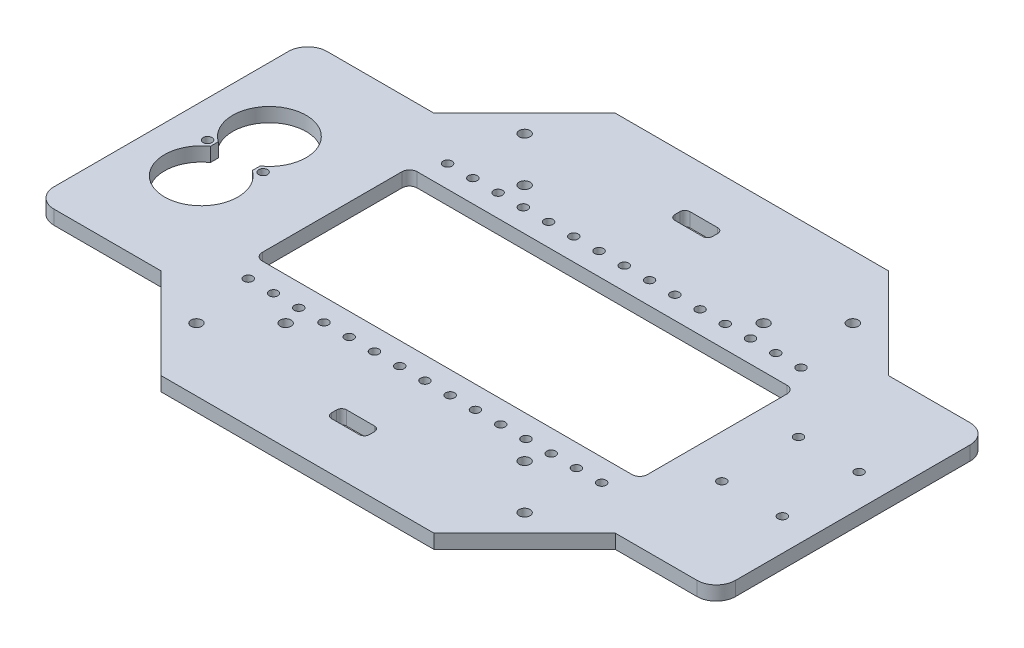
from build123d import *

# Parameters (mm, degrees)
BOSS_EXTRUDE1_DEPTH = 5.588
SKETCH2_R           = 2.159
CUT_EXTRUDE1_DEPTH  = 158.413946399
SKETCH3_W           = 152.51
SKETCH3_H           = 61.34
CUT_EXTRUDE2_DEPTH  = 158.413946399
BOSS_EXTRUDE2_DEPTH = 5.588
BOSS_EXTRUDE3_DEPTH = 5.588
SKETCH7_R           = 1.75
CUT_EXTRUDE4_DEPTH  = 187.865769606
SKETCH8_R           = 1.75
CUT_EXTRUDE6_DEPTH  = 187.865769606
SKETCH9_R           = 1.75
CUT_EXTRUDE8_DEPTH  = 187.865769606
CUT_EXTRUDE9_DEPTH  = 187.865769606
FILLET1_R           = 3


with BuildPart() as part:
    # Sketch1 → Boss-Extrude1 (new body)
    with BuildSketch(Plane(origin=(0, 0, 0), x_dir=(1, 0, 0), z_dir=(0, 1, 0))):
        Polygon((-73.254183378, 28.522688753), (-37.333158894, 64.443713237), (70.824792138, 64.443713237), (106.745816622, 28.522688753), (106.745816622, -79.635262279), (70.824792138, -115.556286763), (-37.333158894, -115.556286763), (-73.254183378, -79.635262279), align=None)
    extrude(amount=BOSS_EXTRUDE1_DEPTH)

    # Sketch2 → Cut-Extrude1 (cut, through all)
    with BuildSketch(Plane(origin=(0, 5.588, 0), x_dir=(1, 0, 0), z_dir=(0, 1, 0))):
        with Locations(Location((-48.254183378, 39.443713237, 0), (0, 0, 270))):
            Circle(SKETCH2_R)
        with Locations(Location((-30.581039332, 21.770569191, 0), (0, 0, 270))):
            Circle(SKETCH2_R)
        with Locations(Location((-48.254183378, -90.556286763, 0), (0, 0, 270))):
            Circle(SKETCH2_R)
        with Locations(Location((-30.581039332, -72.883142717, 0), (0, 0, 270))):
            Circle(SKETCH2_R)
        with Locations(Location((64.072672576, 21.770569191, 0), (0, 0, 270))):
            Circle(SKETCH2_R)
        with Locations(Location((81.745816622, 39.443713237, 0), (0, 0, 270))):
            Circle(SKETCH2_R)
        with Locations(Location((64.072672576, -72.883142717, 0), (0, 0, 270))):
            Circle(SKETCH2_R)
        with Locations(Location((81.745816622, -90.556286763, 0), (0, 0, 270))):
            Circle(SKETCH2_R)
    extrude(amount=-CUT_EXTRUDE1_DEPTH, mode=Mode.SUBTRACT)

    # Sketch3 → Cut-Extrude2 (cut, through all)
    with BuildSketch(Plane(origin=(0, 5.588, 0), x_dir=(1, 0, 0), z_dir=(0, 1, 0))):
        with Locations((16.745816622, -25.556286763)):
            Rectangle(SKETCH3_W, SKETCH3_H)
    extrude(amount=-CUT_EXTRUDE2_DEPTH, mode=Mode.SUBTRACT)

    # Sketch5 → Boss-Extrude2 (add)
    with BuildSketch(Plane(origin=(0, 5.588, 0), x_dir=(1, 0, 0), z_dir=(0, 1, 0))):
        with BuildLine():
            Line((-73.254183378, -79.635262279), (-115.634183378, -79.635262279))
            ThreePointArc((-115.634183378, -79.635262279), (-121.02233705, -77.403415951), (-123.254183378, -72.015262279))
            Line((-123.254183378, -72.015262279), (-123.254183378, 20.902688753))
            ThreePointArc((-123.254183378, 20.902688753), (-121.02233705, 26.290842426), (-115.634183378, 28.522688753))
            Line((-115.634183378, 28.522688753), (-73.254183378, 28.522688753))
            Line((-73.254183378, 28.522688753), (-73.254183378, -79.635262279))
        make_face()
    extrude(amount=-BOSS_EXTRUDE2_DEPTH)

    # Sketch6 → Boss-Extrude3 (add)
    with BuildSketch(Plane(origin=(0, 5.588, 0), x_dir=(1, 0, 0), z_dir=(0, 1, 0))):
        with BuildLine():
            Line((106.745816622, 28.522688753), (139.125816622, 28.522688753))
            ThreePointArc((139.125816622, 28.522688753), (144.513970295, 26.290842426), (146.745816622, 20.902688753))
            Line((146.745816622, 20.902688753), (146.745816622, -72.015262279))
            ThreePointArc((146.745816622, -72.015262279), (144.513970295, -77.403415951), (139.125816622, -79.635262279))
            Line((139.125816622, -79.635262279), (106.745816622, -79.635262279))
            Line((106.745816622, -79.635262279), (106.745816622, 28.522688753))
        make_face()
    extrude(amount=-BOSS_EXTRUDE3_DEPTH)

    # Sketch7 → Cut-Extrude4 (cut, through all)
    with BuildSketch(Plane(origin=(0, 5.588, 0), x_dir=(1, 0, 0), z_dir=(0, 1, 0))):
        with Locations(Location((110.045816622, -10.356286763, 0), (0, 0, 270))):
            Circle(SKETCH7_R)
        with Locations(Location((134.045816622, -10.356286763, 0), (0, 0, 270))):
            Circle(SKETCH7_R)
        with Locations(Location((110.045816622, -40.756286763, 0), (0, 0, 270))):
            Circle(SKETCH7_R)
        with Locations(Location((134.045816622, -40.756286763, 0), (0, 0, 270))):
            Circle(SKETCH7_R)
    extrude(amount=-CUT_EXTRUDE4_DEPTH, mode=Mode.SUBTRACT)

    # Sketch8 → Cut-Extrude6 (cut, through all)
    with BuildSketch(Plane(origin=(0, 5.588, 0), x_dir=(1, 0, 0), z_dir=(0, 1, 0))):
        with Locations(Location((-108.854183378, -25.556286763, 0), (0, 0, 270))):
            Circle(SKETCH8_R)
        with Locations(Location((-86.854183378, -25.556286763, 0), (0, 0, 270))):
            Circle(SKETCH8_R)
        with BuildLine():
            Line((-106.154183378, -24.006705166), (-106.154183378, -27.10586836))
            ThreePointArc((-106.154183378, -27.10586836), (-97.854183378, -53.606286763), (-89.554183378, -27.10586836))
            Line((-89.554183378, -27.10586836), (-89.554183378, -24.006705166))
            ThreePointArc((-89.554183378, -24.006705166), (-97.854183378, 2.493713237), (-106.154183378, -24.006705166))
        make_face()
    extrude(amount=-CUT_EXTRUDE6_DEPTH, mode=Mode.SUBTRACT)

    # Sketch9 → Cut-Extrude8 (cut, through all)
    with BuildSketch(Plane(origin=(0, 5.588, 0), x_dir=(1, 0, 0), z_dir=(0, 1, 0))):
        with Locations(Location((-53.254183378, 13.923713237, 0), (0, 0, 270))):
            Circle(SKETCH9_R)
        with Locations(Location((-43.254183378, 13.923713237, 0), (0, 0, 270))):
            Circle(SKETCH9_R)
        with Locations(Location((-33.254183378, 13.923713237, 0), (0, 0, 270))):
            Circle(SKETCH9_R)
        with Locations(Location((-23.254183378, 13.923713237, 0), (0, 0, 270))):
            Circle(SKETCH9_R)
        with Locations(Location((-13.254183378, 13.923713237, 0), (0, 0, 270))):
            Circle(SKETCH9_R)
        with Locations(Location((-3.254183378, 13.923713237, 0), (0, 0, 270))):
            Circle(SKETCH9_R)
        with Locations(Location((6.745816622, 13.923713237, 0), (0, 0, 270))):
            Circle(SKETCH9_R)
        with Locations(Location((16.745816622, 13.923713237, 0), (0, 0, 270))):
            Circle(SKETCH9_R)
        with Locations(Location((26.745816622, 13.923713237, 0), (0, 0, 270))):
            Circle(SKETCH9_R)
        with Locations(Location((36.745816622, 13.923713237, 0), (0, 0, 270))):
            Circle(SKETCH9_R)
        with Locations(Location((46.745816622, 13.923713237, 0), (0, 0, 270))):
            Circle(SKETCH9_R)
        with Locations(Location((56.745816622, 13.923713237, 0), (0, 0, 270))):
            Circle(SKETCH9_R)
        with Locations(Location((66.745816622, 13.923713237, 0), (0, 0, 270))):
            Circle(SKETCH9_R)
        with Locations(Location((76.745816622, 13.923713237, 0), (0, 0, 270))):
            Circle(SKETCH9_R)
        with Locations(Location((86.745816622, 13.923713237, 0), (0, 0, 270))):
            Circle(SKETCH9_R)
        with Locations(Location((-53.254183378, -65.036286763, 0), (0, 0, 270))):
            Circle(SKETCH9_R)
        with Locations(Location((-43.254183378, -65.036286763, 0), (0, 0, 270))):
            Circle(SKETCH9_R)
        with Locations(Location((-33.254183378, -65.036286763, 0), (0, 0, 270))):
            Circle(SKETCH9_R)
        with Locations(Location((-23.254183378, -65.036286763, 0), (0, 0, 270))):
            Circle(SKETCH9_R)
        with Locations(Location((-13.254183378, -65.036286763, 0), (0, 0, 270))):
            Circle(SKETCH9_R)
        with Locations(Location((-3.254183378, -65.036286763, 0), (0, 0, 270))):
            Circle(SKETCH9_R)
        with Locations(Location((6.745816622, -65.036286763, 0), (0, 0, 270))):
            Circle(SKETCH9_R)
        with Locations(Location((16.745816622, -65.036286763, 0), (0, 0, 270))):
            Circle(SKETCH9_R)
        with Locations(Location((26.745816622, -65.036286763, 0), (0, 0, 270))):
            Circle(SKETCH9_R)
        with Locations(Location((36.745816622, -65.036286763, 0), (0, 0, 270))):
            Circle(SKETCH9_R)
        with Locations(Location((46.745816622, -65.036286763, 0), (0, 0, 270))):
            Circle(SKETCH9_R)
        with Locations(Location((56.745816622, -65.036286763, 0), (0, 0, 270))):
            Circle(SKETCH9_R)
        with Locations(Location((66.745816622, -65.036286763, 0), (0, 0, 270))):
            Circle(SKETCH9_R)
        with Locations(Location((76.745816622, -65.036286763, 0), (0, 0, 270))):
            Circle(SKETCH9_R)
        with Locations(Location((86.745816622, -65.036286763, 0), (0, 0, 270))):
            Circle(SKETCH9_R)
    extrude(amount=-CUT_EXTRUDE8_DEPTH, mode=Mode.SUBTRACT)

    # Sketch10 → Cut-Extrude9 (cut, through all)
    with BuildSketch(Plane(origin=(0, 5.588, 0), x_dir=(1, 0, 0), z_dir=(0, 1, 0))):
        with BuildLine():
            Line((11.245816622, 45.443713237), (22.245816622, 45.443713237))
            ThreePointArc((22.245816622, 45.443713237), (23.660030185, 44.8579268), (24.245816622, 43.443713237))
            Line((24.245816622, 43.443713237), (24.245816622, 41.443713237))
            ThreePointArc((24.245816622, 41.443713237), (23.660030185, 40.029499675), (22.245816622, 39.443713237))
            Line((22.245816622, 39.443713237), (11.245816622, 39.443713237))
            ThreePointArc((11.245816622, 39.443713237), (9.83160306, 40.029499675), (9.245816622, 41.443713237))
            Line((9.245816622, 41.443713237), (9.245816622, 43.443713237))
            ThreePointArc((9.245816622, 43.443713237), (9.83160306, 44.8579268), (11.245816622, 45.443713237))
        make_face()
        with BuildLine():
            Line((11.245816622, -90.556286763), (22.245816622, -90.556286763))
            ThreePointArc((22.245816622, -90.556286763), (23.660030185, -91.1420732), (24.245816622, -92.556286763))
            Line((24.245816622, -92.556286763), (24.245816622, -94.556286763))
            ThreePointArc((24.245816622, -94.556286763), (23.660030185, -95.970500325), (22.245816622, -96.556286763))
            Line((22.245816622, -96.556286763), (11.245816622, -96.556286763))
            ThreePointArc((11.245816622, -96.556286763), (9.83160306, -95.970500325), (9.245816622, -94.556286763))
            Line((9.245816622, -94.556286763), (9.245816622, -92.556286763))
            ThreePointArc((9.245816622, -92.556286763), (9.83160306, -91.1420732), (11.245816622, -90.556286763))
        make_face()
    extrude(amount=-CUT_EXTRUDE9_DEPTH, mode=Mode.SUBTRACT)

    # Fillet1
    fillet1_edges = [part.edges().sort_by_distance(p)[0] for p in [
        (-59.509183378, 2.794, 56.226286763),
        (-59.509183378, 2.794, -5.113713237),
        (93.000816622, 2.794, -5.113713237),
        (93.000816622, 2.794, 56.226286763),
    ]]
    fillet(fillet1_edges, radius=FILLET1_R)


solid = part.part
